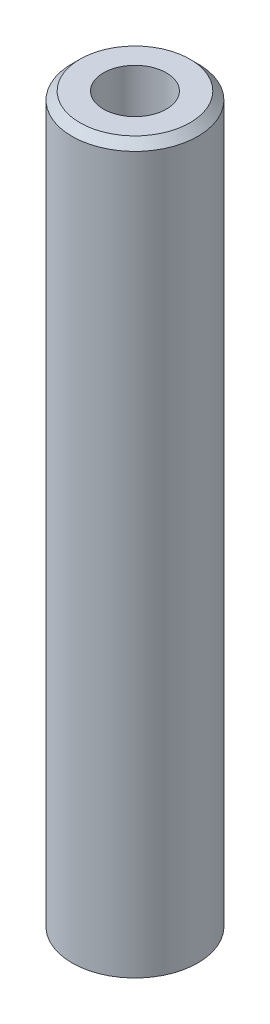
from build123d import *

# Parameters (mm, degrees)
SKETCH1_R           = 4
SKETCH1_R_2         = 2
BOSS_EXTRUDE1_DEPTH = 46
CHAMFER1_SIZE       = 0.5


with BuildPart() as part:
    # Sketch1 → Boss-Extrude1 (new body)
    with BuildSketch(Plane(origin=(0, 0, 0), x_dir=(1, 0, 0), z_dir=(0, 1, 0))):
        with Locations(Location((0, 0, 0), (0, 0, 270))):
            Circle(SKETCH1_R)
        with Locations(Location((0, 0, 0), (0, 0, 270))):
            Circle(SKETCH1_R_2, mode=Mode.SUBTRACT)
    extrude(amount=BOSS_EXTRUDE1_DEPTH)

    # Chamfer1
    chamfer1_edges = [part.edges().sort_by_distance(p)[0] for p in [
        (0, 46, -4),
    ]]
    chamfer(chamfer1_edges, length=CHAMFER1_SIZE)


solid = part.part
